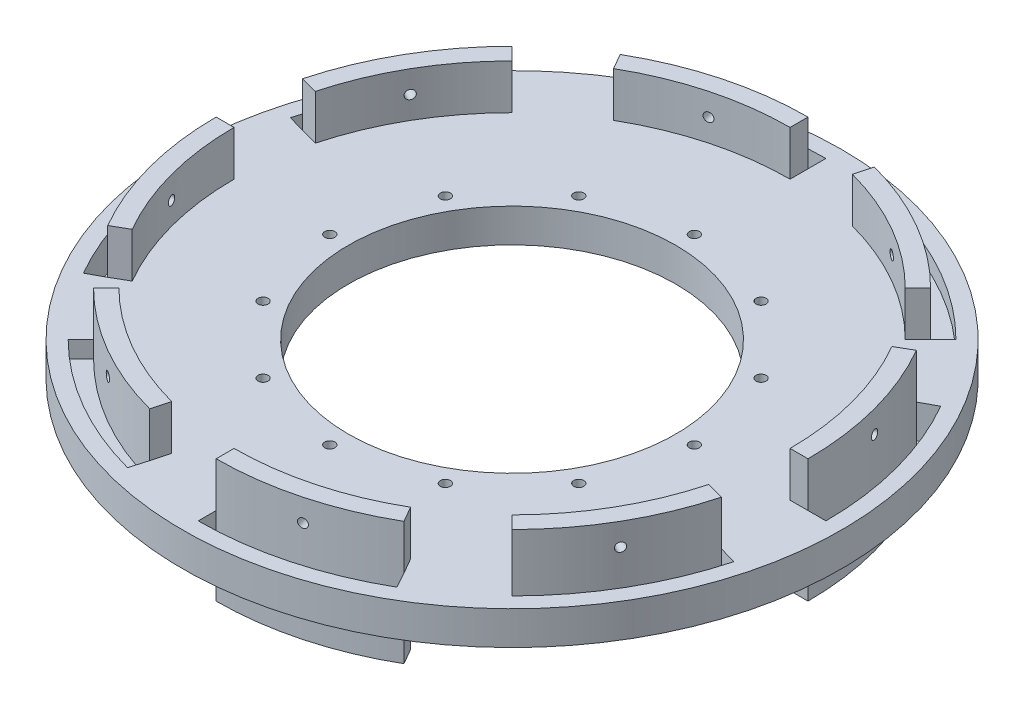
from build123d import *

# Parameters (mm, degrees)
SKETCH1_W                       = 127.635
SKETCH1_H                       = 127.635
BOSS_EXTRUDE1_DEPTH             = 9.525
SKETCH12_R                      = 93.345
BOSS_EXTRUDE2_DEPTH             = 9.525
SKETCH5_R                       = 46.355
CUT_EXTRUDE1_DEPTH              = 9.525
SKETCH11_R                      = 1.4351
CUT_EXTRUDE3_DEPTH              = 223.465342104
CIRPATTERN1_COUNT               = 12
BOTTOM_SUPPORT_HOLE_DEPTH       = 4.7625
BOTTOM_START                    = -12.7
BOTTOM_SUPPORT_GUIDE_DEPTH      = 12.7
SKETCH16_R                      = 1.27
BOTTOM_SUPPORT_BOLT_HOLE_DEPTH  = 12.7
SUPPORT_PATTERN_COUNT           = 4
SUPPORT_PATTERN_COPY_1_DEPTH    = 4.7625
SUPPORT_PATTERN_COPY_2_DEPTH    = 4.7625
SUPPORT_PATTERN_COPY_3_DEPTH    = 4.7625
SUPPORT_START                   = -12.7
SUPPORT_PATTERN_COPY_4_DEPTH    = 12.7
SUPPORT_PATTERN_COPY_5_DEPTH    = 12.7
SUPPORT_PATTERN_COPY_6_DEPTH    = 12.7
SUPPORT_PATTERN_COPY_7_SKETCH_R = 1.27
SUPPORT_PATTERN_COPY_7_DEPTH    = 12.7
SUPPORT_PATTERN_COPY_8_SKETCH_R = 1.27
SUPPORT_PATTERN_COPY_8_DEPTH    = 12.7
SUPPORT_PATTERN_COPY_9_SKETCH_R = 1.27
SUPPORT_PATTERN_COPY_9_DEPTH    = 12.7
TOP_START                       = 4.7625
TOP_SUPPORT_HOLE_DEPTH          = 4.7625
TOP_SUPPORT_GUIDE_DEPTH         = 12.7
SKETCH29_R                      = 1.27
TOP_SUPPORT_BOLT_HOLE_DEPTH     = 12.7
CIRPATTERN4_COUNT               = 4


with BuildPart() as part:
    # Sketch1 → Boss-Extrude1 (new body)
    with BuildSketch(Plane(origin=(0, 0, 0), x_dir=(1, 0, 0), z_dir=(0, 1, 0))):
        with Locations((63.8175, 63.8175)):
            Rectangle(SKETCH1_W, SKETCH1_H)
    extrude(amount=BOSS_EXTRUDE1_DEPTH)

    # Sketch12 → Boss-Extrude2 (add)
    with BuildSketch(Plane.XZ):
        with Locations(Location((63.8175, -63.8175, 0), (0, 0, 270))):
            Circle(SKETCH12_R)
    extrude(amount=-BOSS_EXTRUDE2_DEPTH)

    # Sketch5 → Cut-Extrude1 (cut)
    with BuildSketch(Plane(origin=(0, 9.525, 0), x_dir=(1, 0, 0), z_dir=(0, 1, 0))):
        with Locations(Location((63.8175, 63.8175, 0), (0, 0, 270))):
            Circle(SKETCH5_R)
    extrude(amount=-CUT_EXTRUDE1_DEPTH, mode=Mode.SUBTRACT)

    # Sketch11 → Cut-Extrude3 (cut, through all)
    with BuildSketch(Plane(origin=(0, 9.525, 0), x_dir=(1, 0, 0), z_dir=(0, 1, 0))):
        with Locations(Location((63.8175, 115.443, 0), (0, 0, 270))):
            Circle(SKETCH11_R)
    cut_extrude3 = extrude(amount=-CUT_EXTRUDE3_DEPTH, mode=Mode.SUBTRACT)

    # CirPattern1: Cut-Extrude3 ×12 about axis
    cirpattern1_axis = Axis((63.8175, 0, -63.8175), (0, 1, 0))
    for i in range(1, CIRPATTERN1_COUNT):
        add(cut_extrude3.rotate(cirpattern1_axis, i * 360 / CIRPATTERN1_COUNT), mode=Mode.SUBTRACT)

    # Sketch14 → Bottom support hole (cut)
    with BuildSketch(Plane.XZ.offset(-9.525)):
        with BuildLine():
            Line((147.6375, -63.8175), (152.7175, -63.8175))
            ThreePointArc((152.7175, -63.8175), (149.696832172, -86.794669228), (140.840102796, -108.21038973))
            Line((140.840102796, -108.21038973), (136.380758996, -105.774213931))
            ThreePointArc((136.380758996, -105.774213931), (144.774416842, -85.53776739), (147.6375, -63.8175))
        make_face()
    bottom_support_hole = extrude(amount=BOTTOM_SUPPORT_HOLE_DEPTH, mode=Mode.SUBTRACT)

    # Sketch15 → Bottom support guide (add)
    with BuildSketch(Plane.XZ.offset(-9.525).offset(BOTTOM_START)):
        with BuildLine():
            Line((142.5575, -63.8175), (147.6375, -63.8175))
            ThreePointArc((147.6375, -63.8175), (144.774416842, -85.53776739), (136.380758996, -105.774213931))
            Line((136.380758996, -105.774213931), (131.982985723, -103.231382784))
            ThreePointArc((131.982985723, -103.231382784), (139.867937033, -84.221387548), (142.5575, -63.8175))
        make_face()
    bottom_support_guide = extrude(amount=BOTTOM_SUPPORT_GUIDE_DEPTH)

    # Sketch16 → Bottom support bolt hole (cut, symmetric)
    with BuildSketch(Plane(origin=(153.69605101, 0, -41.235751742), x_dir=(-0.2591298901183034, 0, -0.9658424820058786), z_dir=(0.9658424820058786, 0, -0.2591298901183034))):
        with Locations(Location((45.103898223, 15.875, 0), (0, 0, 180))):
            Circle(SKETCH16_R)
    bottom_support_bolt_hole = extrude(amount=BOTTOM_SUPPORT_BOLT_HOLE_DEPTH, both=True, mode=Mode.SUBTRACT)

    # Support mirror: Bottom support hole, Bottom support guide, Bottom support bolt hole across plane
    add(bottom_support_hole.mirror(Plane.ZX.offset(4.7625)), mode=Mode.SUBTRACT)
    add(bottom_support_guide.mirror(Plane.ZX.offset(4.7625)))
    add(bottom_support_bolt_hole.mirror(Plane.ZX.offset(4.7625)), mode=Mode.SUBTRACT)

    # Support pattern: Bottom support hole, Bottom support guide, Bottom support bolt hole ×4 about axis
    support_pattern_axis = Axis((63.8175, 0, -63.8175), (0, 1, 0))
    add([bottom_support_hole.rotate(support_pattern_axis, i * 360 / SUPPORT_PATTERN_COUNT) for i in range(1, SUPPORT_PATTERN_COUNT)], mode=Mode.SUBTRACT)
    add([bottom_support_guide.rotate(support_pattern_axis, i * 360 / SUPPORT_PATTERN_COUNT) for i in range(1, SUPPORT_PATTERN_COUNT)])
    add([bottom_support_bolt_hole.rotate(support_pattern_axis, i * 360 / SUPPORT_PATTERN_COUNT) for i in range(1, SUPPORT_PATTERN_COUNT)], mode=Mode.SUBTRACT)

    # Support pattern copy 1 sketch → Support pattern copy 1 (cut)
    with BuildSketch(Plane(origin=(127.635, 0, 0), x_dir=(0, 0, -1), z_dir=(0, 1, 0))):
        with BuildLine():
            Line((147.6375, 63.8175), (152.7175, 63.8175))
            ThreePointArc((152.7175, 63.8175), (149.696832172, 86.794669228), (140.840102796, 108.21038973))
            Line((140.840102796, 108.21038973), (136.380758996, 105.774213931))
            ThreePointArc((136.380758996, 105.774213931), (144.774416842, 85.53776739), (147.6375, 63.8175))
        make_face()
    extrude(amount=SUPPORT_PATTERN_COPY_1_DEPTH, mode=Mode.SUBTRACT)

    # Support pattern copy 2 sketch → Support pattern copy 2 (cut)
    with BuildSketch(Plane(origin=(127.635, 0, -127.635), x_dir=(-1, 0, 0), z_dir=(0, 1, 0))):
        with BuildLine():
            Line((147.6375, 63.8175), (152.7175, 63.8175))
            ThreePointArc((152.7175, 63.8175), (149.696832172, 86.794669228), (140.840102796, 108.21038973))
            Line((140.840102796, 108.21038973), (136.380758996, 105.774213931))
            ThreePointArc((136.380758996, 105.774213931), (144.774416842, 85.53776739), (147.6375, 63.8175))
        make_face()
    extrude(amount=SUPPORT_PATTERN_COPY_2_DEPTH, mode=Mode.SUBTRACT)

    # Support pattern copy 3 sketch → Support pattern copy 3 (cut)
    with BuildSketch(Plane(origin=(0, 0, -127.635), x_dir=(0, 0, 1), z_dir=(0, 1, 0))):
        with BuildLine():
            Line((147.6375, 63.8175), (152.7175, 63.8175))
            ThreePointArc((152.7175, 63.8175), (149.696832172, 86.794669228), (140.840102796, 108.21038973))
            Line((140.840102796, 108.21038973), (136.380758996, 105.774213931))
            ThreePointArc((136.380758996, 105.774213931), (144.774416842, 85.53776739), (147.6375, 63.8175))
        make_face()
    extrude(amount=SUPPORT_PATTERN_COPY_3_DEPTH, mode=Mode.SUBTRACT)

    # Support pattern copy 4 sketch → Support pattern copy 4 (add)
    with BuildSketch(Plane(origin=(127.635, 0, 0), x_dir=(0, 0, -1), z_dir=(0, 1, 0)).offset(SUPPORT_START)):
        with BuildLine():
            Line((142.5575, 63.8175), (147.6375, 63.8175))
            ThreePointArc((147.6375, 63.8175), (144.774416842, 85.53776739), (136.380758996, 105.774213931))
            Line((136.380758996, 105.774213931), (131.982985723, 103.231382784))
            ThreePointArc((131.982985723, 103.231382784), (139.867937033, 84.221387548), (142.5575, 63.8175))
        make_face()
    extrude(amount=SUPPORT_PATTERN_COPY_4_DEPTH)

    # Support pattern copy 5 sketch → Support pattern copy 5 (add)
    with BuildSketch(Plane(origin=(127.635, 0, -127.635), x_dir=(-1, 0, 0), z_dir=(0, 1, 0)).offset(SUPPORT_START)):
        with BuildLine():
            Line((142.5575, 63.8175), (147.6375, 63.8175))
            ThreePointArc((147.6375, 63.8175), (144.774416842, 85.53776739), (136.380758996, 105.774213931))
            Line((136.380758996, 105.774213931), (131.982985723, 103.231382784))
            ThreePointArc((131.982985723, 103.231382784), (139.867937033, 84.221387548), (142.5575, 63.8175))
        make_face()
    extrude(amount=SUPPORT_PATTERN_COPY_5_DEPTH)

    # Support pattern copy 6 sketch → Support pattern copy 6 (add)
    with BuildSketch(Plane(origin=(0, 0, -127.635), x_dir=(0, 0, 1), z_dir=(0, 1, 0)).offset(SUPPORT_START)):
        with BuildLine():
            Line((142.5575, 63.8175), (147.6375, 63.8175))
            ThreePointArc((147.6375, 63.8175), (144.774416842, 85.53776739), (136.380758996, 105.774213931))
            Line((136.380758996, 105.774213931), (131.982985723, 103.231382784))
            ThreePointArc((131.982985723, 103.231382784), (139.867937033, 84.221387548), (142.5575, 63.8175))
        make_face()
    extrude(amount=SUPPORT_PATTERN_COPY_6_DEPTH)

    # Support pattern copy 7 sketch → Support pattern copy 7 (cut, symmetric)
    with BuildSketch(Plane(origin=(86.399248258, 9.525, -153.69605101), x_dir=(-0.9658424820058786, 0, 0.25912989011830334), z_dir=(-0.25912989011830334, 0, -0.9658424820058786))):
        with Locations((45.103898223, -15.875)):
            Circle(SUPPORT_PATTERN_COPY_7_SKETCH_R)
    extrude(amount=SUPPORT_PATTERN_COPY_7_DEPTH, both=True, mode=Mode.SUBTRACT)

    # Support pattern copy 8 sketch → Support pattern copy 8 (cut, symmetric)
    with BuildSketch(Plane(origin=(-26.06105101, 9.525, -86.399248258), x_dir=(0.2591298901183033, 0, 0.9658424820058786), z_dir=(-0.9658424820058786, 0, 0.2591298901183033))):
        with Locations((45.103898223, -15.875)):
            Circle(SUPPORT_PATTERN_COPY_8_SKETCH_R)
    extrude(amount=SUPPORT_PATTERN_COPY_8_DEPTH, both=True, mode=Mode.SUBTRACT)

    # Support pattern copy 9 sketch → Support pattern copy 9 (cut, symmetric)
    with BuildSketch(Plane(origin=(41.235751742, 9.525, 26.06105101), x_dir=(0.9658424820058786, 0, -0.25912989011830323), z_dir=(0.25912989011830323, 0, 0.9658424820058786))):
        with Locations((45.103898223, -15.875)):
            Circle(SUPPORT_PATTERN_COPY_9_SKETCH_R)
    extrude(amount=SUPPORT_PATTERN_COPY_9_DEPTH, both=True, mode=Mode.SUBTRACT)

    # Sketch25 → Top support hole (cut)
    with BuildSketch(Plane.XZ.offset(-9.525).offset(TOP_START)):
        with BuildLine():
            Line((123.087190399, -4.547809601), (126.679292847, -0.955707153))
            ThreePointArc((126.679292847, -0.955707153), (140.790670316, -19.338954031), (149.671218106, -40.744808623))
            Line((149.671218106, -40.744808623), (144.795349438, -42.175404436))
            ThreePointArc((144.795349438, -42.175404436), (136.421233243, -21.930863478), (123.087190399, -4.547809601))
        make_face()
    top_support_hole = extrude(amount=-TOP_SUPPORT_HOLE_DEPTH, mode=Mode.SUBTRACT)

    # Sketch27 → Top support guide (add)
    with BuildSketch(Plane(origin=(-7.938423225, 9.525, 69.121219833), x_dir=(1, 0, 0), z_dir=(0, -1, 0))):
        with BuildLine():
            Line((131.025613624, -73.669029434), (127.433511176, -77.261131883))
            ThreePointArc((127.433511176, -77.261131883), (139.959430211, -93.590667343), (147.826024212, -112.608266425))
            Line((147.826024212, -112.608266425), (152.733772663, -111.296624269))
            ThreePointArc((152.733772663, -111.296624269), (144.359656468, -91.052083311), (131.025613624, -73.669029434))
        make_face()
    top_support_guide = extrude(amount=-TOP_SUPPORT_GUIDE_DEPTH)

    # Sketch29 → Top support bolt hole (cut, symmetric)
    with BuildSketch(Plane(origin=(90.381164695, 0, 52.142814494), x_dir=(-0.4997212660736274, 0, 0.8661862710951791), z_dir=(-0.8661862710951791, 0, -0.4997212660736274))):
        with Locations(Location((-87.172071643, 15.875, 0), (0, 0, 180))):
            Circle(SKETCH29_R)
    top_support_bolt_hole = extrude(amount=TOP_SUPPORT_BOLT_HOLE_DEPTH, both=True, mode=Mode.SUBTRACT)

    # CirPattern4: Bottom support hole, Bottom support guide, Bottom support bolt hole, Top support hole, Top support guide, Top support bolt hole ×4 about axis
    cirpattern4_axis = Axis((63.8175, 0, -63.8175), (0, 1, 0))
    add([bottom_support_hole.rotate(cirpattern4_axis, i * 360 / CIRPATTERN4_COUNT) for i in range(1, CIRPATTERN4_COUNT)], mode=Mode.SUBTRACT)
    add([bottom_support_guide.rotate(cirpattern4_axis, i * 360 / CIRPATTERN4_COUNT) for i in range(1, CIRPATTERN4_COUNT)])
    add([bottom_support_bolt_hole.rotate(cirpattern4_axis, i * 360 / CIRPATTERN4_COUNT) for i in range(1, CIRPATTERN4_COUNT)], mode=Mode.SUBTRACT)
    add([top_support_hole.rotate(cirpattern4_axis, i * 360 / CIRPATTERN4_COUNT) for i in range(1, CIRPATTERN4_COUNT)], mode=Mode.SUBTRACT)
    add([top_support_guide.rotate(cirpattern4_axis, i * 360 / CIRPATTERN4_COUNT) for i in range(1, CIRPATTERN4_COUNT)])
    add([top_support_bolt_hole.rotate(cirpattern4_axis, i * 360 / CIRPATTERN4_COUNT) for i in range(1, CIRPATTERN4_COUNT)], mode=Mode.SUBTRACT)


solid = part.part
